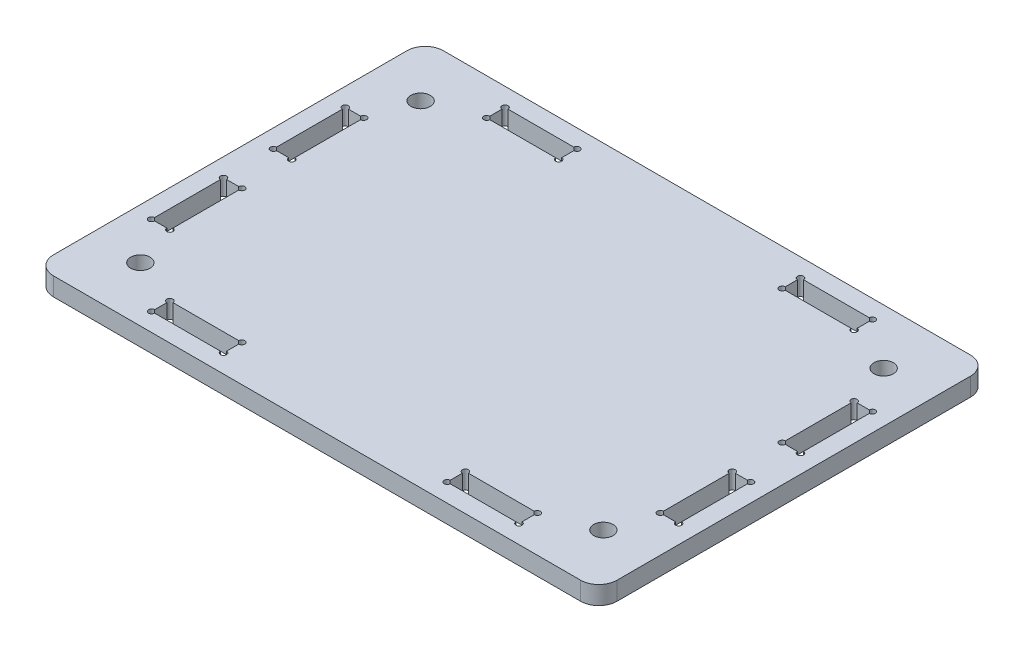
from build123d import *

# Parameters (mm, degrees)
SKETCH5_R           = 1.5875
BOSS_EXTRUDE1_DEPTH = 3


with BuildPart() as part:
    # Sketch5 → Boss-Extrude1 (new body)
    with BuildSketch(Plane(origin=(0, 0, 0), x_dir=(1, 0, 0), z_dir=(0, 1, 0))):
        with BuildLine():
            Line((-3.25, -7), (83.25, -7))
            ThreePointArc((83.25, -7), (85.371320344, -6.121320344), (86.25, -4))
            Line((86.25, -4), (86.25, 54))
            ThreePointArc((86.25, 54), (85.371320344, 56.121320344), (83.25, 57))
            Line((83.25, 57), (-3.25, 57))
            ThreePointArc((-3.25, 57), (-5.371320344, 56.121320344), (-6.25, 54))
            Line((-6.25, 54), (-6.25, -4))
            ThreePointArc((-6.25, -4), (-5.371320344, -6.121320344), (-3.25, -7))
        make_face()
        with Locations(Location((2, 2, 0), (0, 0, 270))):
            Circle(SKETCH5_R, mode=Mode.SUBTRACT)
        with Locations(Location((2, 48, 0), (0, 0, 270))):
            Circle(SKETCH5_R, mode=Mode.SUBTRACT)
        with Locations(Location((78, 48, 0), (0, 0, 270))):
            Circle(SKETCH5_R, mode=Mode.SUBTRACT)
        with Locations(Location((78, 2, 0), (0, 0, 270))):
            Circle(SKETCH5_R, mode=Mode.SUBTRACT)
        with BuildLine():
            Line((10.353326987, 54), (21.153326987, 54))
            ThreePointArc((21.153326987, 54), (22.006880378, 54.353553391), (21.653326987, 53.5))
            Line((21.653326987, 53.5), (21.653326987, 51.5))
            ThreePointArc((21.653326987, 51.5), (22.006880378, 50.646446609), (21.153326987, 51))
            Line((21.153326987, 51), (10.353326987, 51))
            ThreePointArc((10.353326987, 51), (9.499773597, 50.646446609), (9.853326987, 51.5))
            Line((9.853326987, 51.5), (9.853326987, 53.5))
            ThreePointArc((9.853326987, 53.5), (9.499773597, 54.353553391), (10.353326987, 54))
        make_face(mode=Mode.SUBTRACT)
        with BuildLine():
            Line((58.85, 54), (69.65, 54))
            ThreePointArc((69.65, 54), (70.503553391, 54.353553391), (70.15, 53.5))
            Line((70.15, 53.5), (70.15, 51.5))
            ThreePointArc((70.15, 51.5), (70.503553391, 50.646446609), (69.65, 51))
            Line((69.65, 51), (58.85, 51))
            ThreePointArc((58.85, 51), (57.996446609, 50.646446609), (58.35, 51.5))
            Line((58.35, 51.5), (58.35, 53.5))
            ThreePointArc((58.35, 53.5), (57.996446609, 54.353553391), (58.85, 54))
        make_face(mode=Mode.SUBTRACT)
        with BuildLine():
            Line((10.35, -1), (21.15, -1))
            ThreePointArc((21.15, -1), (22.003553391, -0.646446609), (21.65, -1.5))
            Line((21.65, -1.5), (21.65, -3.5))
            ThreePointArc((21.65, -3.5), (22.003553391, -4.353553391), (21.15, -4))
            Line((21.15, -4), (10.35, -4))
            ThreePointArc((10.35, -4), (9.496446609, -4.353553391), (9.85, -3.5))
            Line((9.85, -3.5), (9.85, -1.5))
            ThreePointArc((9.85, -1.5), (9.496446609, -0.646446609), (10.35, -1))
        make_face(mode=Mode.SUBTRACT)
        with BuildLine():
            Line((58.85, -1), (69.65, -1))
            ThreePointArc((69.65, -1), (70.503553391, -0.646446609), (70.15, -1.5))
            Line((70.15, -1.5), (70.15, -3.5))
            ThreePointArc((70.15, -3.5), (70.503553391, -4.353553391), (69.65, -4))
            Line((69.65, -4), (58.85, -4))
            ThreePointArc((58.85, -4), (57.996446609, -4.353553391), (58.35, -3.5))
            Line((58.35, -3.5), (58.35, -1.5))
            ThreePointArc((58.35, -1.5), (57.996446609, -0.646446609), (58.85, -1))
        make_face(mode=Mode.SUBTRACT)
        with BuildLine():
            Line((-3.25, 9.6), (-3.25, 20.4))
            ThreePointArc((-3.25, 20.4), (-3.603553391, 21.253553391), (-2.75, 20.9))
            Line((-2.75, 20.9), (-0.75, 20.9))
            ThreePointArc((-0.75, 20.9), (0.103553391, 21.253553391), (-0.25, 20.4))
            Line((-0.25, 20.4), (-0.25, 9.6))
            ThreePointArc((-0.25, 9.6), (0.103553391, 8.746446609), (-0.75, 9.1))
            Line((-0.75, 9.1), (-2.75, 9.1))
            ThreePointArc((-2.75, 9.1), (-3.603553391, 8.746446609), (-3.25, 9.6))
        make_face(mode=Mode.SUBTRACT)
        with BuildLine():
            Line((-3.25, 29.6), (-3.25, 40.4))
            ThreePointArc((-3.25, 40.4), (-3.603553391, 41.253553391), (-2.75, 40.9))
            Line((-2.75, 40.9), (-0.75, 40.9))
            ThreePointArc((-0.75, 40.9), (0.103553391, 41.253553391), (-0.25, 40.4))
            Line((-0.25, 40.4), (-0.25, 29.6))
            ThreePointArc((-0.25, 29.6), (0.103553391, 28.746446609), (-0.75, 29.1))
            Line((-0.75, 29.1), (-2.75, 29.1))
            ThreePointArc((-2.75, 29.1), (-3.603553391, 28.746446609), (-3.25, 29.6))
        make_face(mode=Mode.SUBTRACT)
        with BuildLine():
            Line((80.25, 9.6), (80.25, 20.4))
            ThreePointArc((80.25, 20.4), (79.896446609, 21.253553391), (80.75, 20.9))
            Line((80.75, 20.9), (82.75, 20.9))
            ThreePointArc((82.75, 20.9), (83.603553391, 21.253553391), (83.25, 20.4))
            Line((83.25, 20.4), (83.25, 9.6))
            ThreePointArc((83.25, 9.6), (83.603553391, 8.746446609), (82.75, 9.1))
            Line((82.75, 9.1), (80.75, 9.1))
            ThreePointArc((80.75, 9.1), (79.896446609, 8.746446609), (80.25, 9.6))
        make_face(mode=Mode.SUBTRACT)
        with BuildLine():
            Line((80.25, 29.6), (80.25, 40.4))
            ThreePointArc((80.25, 40.4), (79.896446609, 41.253553391), (80.75, 40.9))
            Line((80.75, 40.9), (82.75, 40.9))
            ThreePointArc((82.75, 40.9), (83.603553391, 41.253553391), (83.25, 40.4))
            Line((83.25, 40.4), (83.25, 29.6))
            ThreePointArc((83.25, 29.6), (83.603553391, 28.746446609), (82.75, 29.1))
            Line((82.75, 29.1), (80.75, 29.1))
            ThreePointArc((80.75, 29.1), (79.896446609, 28.746446609), (80.25, 29.6))
        make_face(mode=Mode.SUBTRACT)
    extrude(amount=BOSS_EXTRUDE1_DEPTH)


solid = part.part
